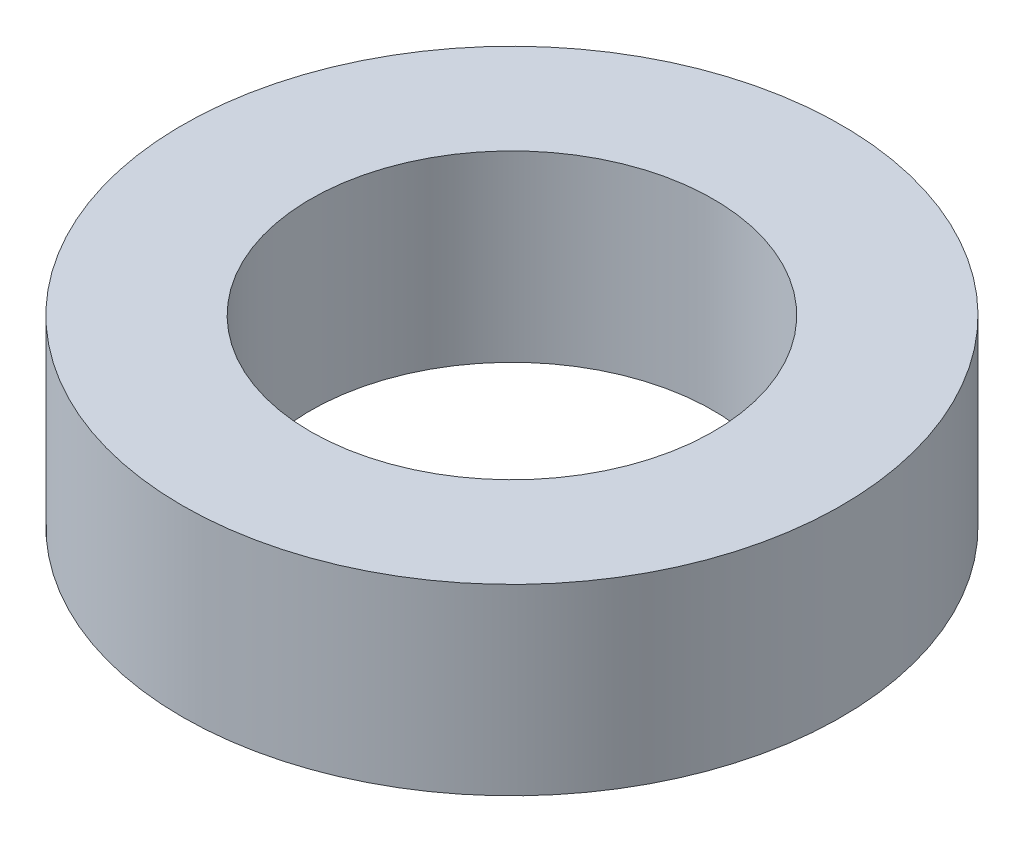
from build123d import *

# Parameters (mm, degrees)
SKETCH1_R              = 18
BOSS_EXTRUDE1_DEPTH    = 5
M24X2_0_TAPPED_HOLE1_D = 22


with BuildPart() as part:
    # Sketch1 → Boss-Extrude1 (new, symmetric)
    with BuildSketch(Plane(origin=(0, 0, 0), x_dir=(1, 0, 0), z_dir=(0, 1, 0))):
        with Locations(Location((0, 0, 0), (0, 0, 270))):
            Circle(SKETCH1_R)
    extrude(amount=BOSS_EXTRUDE1_DEPTH, both=True)

    # M24x2.0 Tapped Hole1 (through all)
    with Locations(Plane(origin=(0, 5, 0), x_dir=(1, 0, 0), z_dir=(0, 1, 0))):
        with Locations((0, 0)):
            Hole(M24X2_0_TAPPED_HOLE1_D / 2)


solid = part.part
